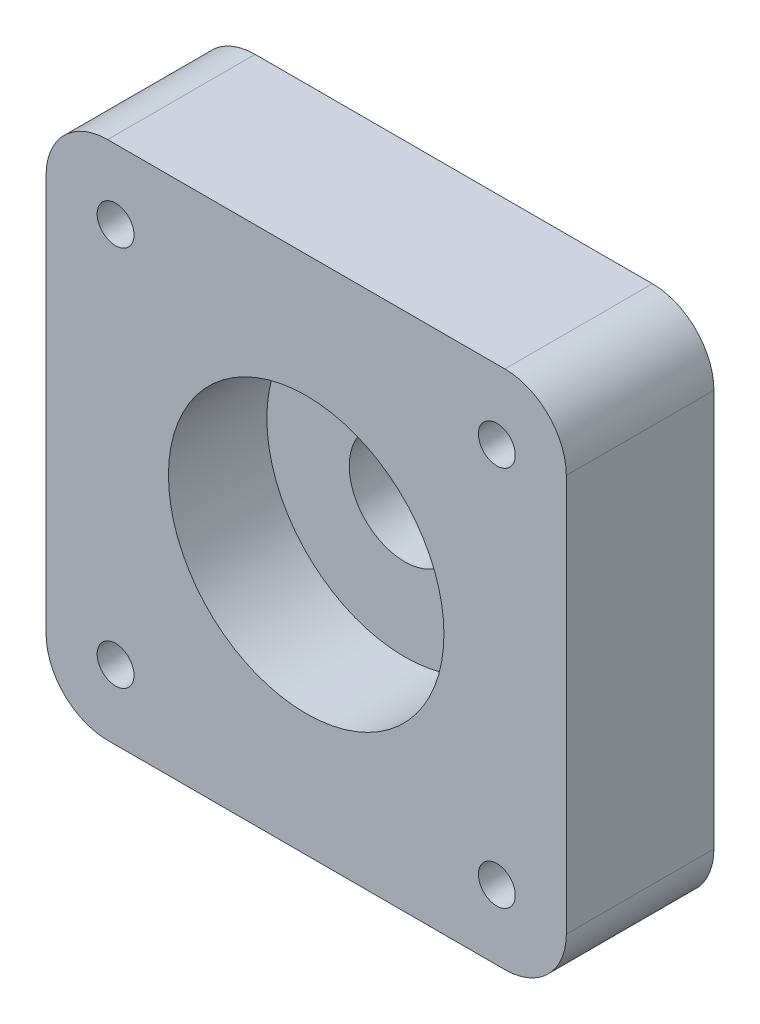
from build123d import *

# Parameters (mm, degrees)
CROQUIS1_W              = 42.3
CROQUIS1_H              = 42.3
CROQUIS1_R              = 1.5
SALIENTE_EXTRUIR1_DEPTH = 6
REDONDEO1_R             = 5
CROQUIS2_R              = 11.2
CORTAR_EXTRUIR1_DEPTH   = 8
CROQUIS3_R              = 4.5
CORTAR_EXTRUIR2_DEPTH   = 10


with BuildPart() as part:
    # Croquis1 → Saliente-Extruir1 (new, symmetric)
    with BuildSketch(Plane.XY):
        Rectangle(CROQUIS1_W, CROQUIS1_H)
        with Locations((-15.5, 15.5)):
            Circle(CROQUIS1_R, mode=Mode.SUBTRACT)
        with Locations((-15.5, -15.5)):
            Circle(CROQUIS1_R, mode=Mode.SUBTRACT)
        with Locations(Location((15.5, -15.5, 0), (0, 0, 180))):
            Circle(CROQUIS1_R, mode=Mode.SUBTRACT)
        with Locations(Location((15.5, 15.5, 0), (0, 0, 180))):
            Circle(CROQUIS1_R, mode=Mode.SUBTRACT)
    extrude(amount=SALIENTE_EXTRUIR1_DEPTH, both=True)

    # Redondeo1
    redondeo1_edges = [part.edges().sort_by_distance(p)[0] for p in [
        (21.15, -21.15, 0),
        (-21.15, -21.15, 0),
        (-21.15, 21.15, 0),
        (21.15, 21.15, 0),
    ]]
    fillet(redondeo1_edges, radius=REDONDEO1_R)

    # Croquis2 → Cortar-Extruir1 (cut)
    with BuildSketch(Plane.XY.offset(6)):
        Circle(CROQUIS2_R)
    extrude(amount=-CORTAR_EXTRUIR1_DEPTH, mode=Mode.SUBTRACT)

    # Croquis3 → Cortar-Extruir2 (cut)
    with BuildSketch(Plane(origin=(0, 0, -6), x_dir=(-1, 0, 0), z_dir=(0, 0, -1))):
        Circle(CROQUIS3_R)
    extrude(amount=-CORTAR_EXTRUIR2_DEPTH, mode=Mode.SUBTRACT)


solid = part.part
